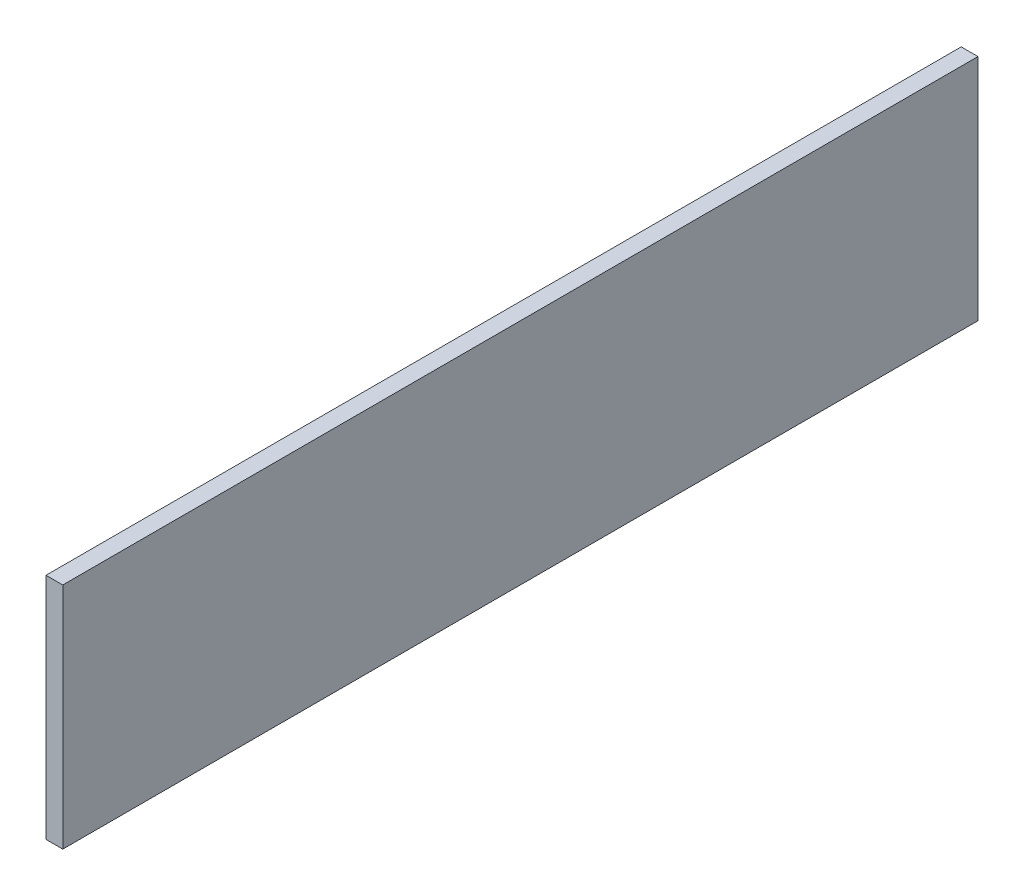
from build123d import *

# Parameters (mm, degrees)
SKETCH1_W           = 304.8
SKETCH1_H           = 76.2
BOSS_EXTRUDE1_DEPTH = 5.588


with BuildPart() as part:
    # Sketch1 → Boss-Extrude1 (new body)
    with BuildSketch(Plane(origin=(0, 0, 0), x_dir=(0, 0, -1), z_dir=(1, 0, 0))):
        Rectangle(SKETCH1_W, SKETCH1_H)
    extrude(amount=BOSS_EXTRUDE1_DEPTH)


solid = part.part
